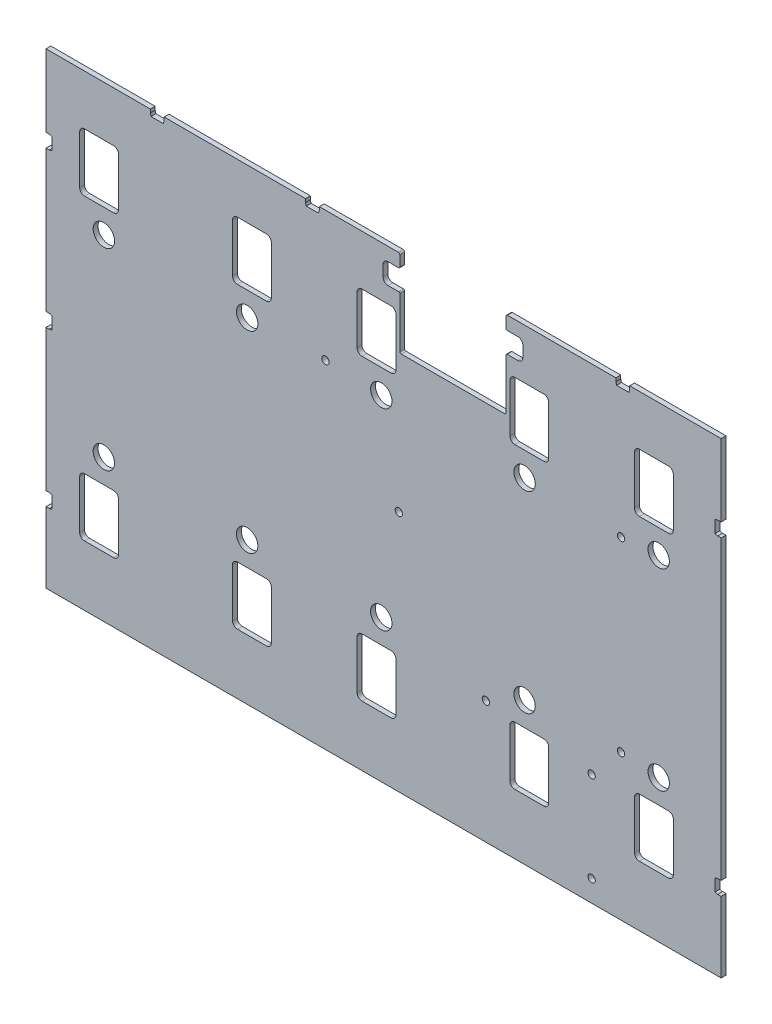
from build123d import *

# Parameters (mm, degrees)
SKETCH1_W            = 441.979400076
SKETCH1_H            = 305.81676
BOSS_EXTRUDE1_DEPTH  = 3.175
CUT_EXTRUDE1_DEPTH   = 271.654843319
CUT_EXTRUDE2_DEPTH   = 271.654843319
LPATTERN1_COUNT      = 3
LPATTERN1_PITCH      = 181.613999992
LPATTERN2_COUNT      = 2
LPATTERN2_PITCH      = 181.613999992
CUT_EXTRUDE3_DEPTH   = 271.654843319
SKETCH5_R            = 7
CUT_EXTRUDE4_DEPTH   = 271.654843319
M4_CLEARANCE_HOLE1_D = 4.8
FILLET1_R            = 1
CUT_EXTRUDE5_DEPTH   = 271.654843319


with BuildPart() as part:
    # Sketch1 → Boss-Extrude1 (new body)
    with BuildSketch(Plane.XY):
        with Locations((0, -3.32067)):
            Rectangle(SKETCH1_W, SKETCH1_H)
    extrude(amount=BOSS_EXTRUDE1_DEPTH)

    # Sketch2 → Cut-Extrude1 (cut, through all)
    with BuildSketch(Plane.XY.offset(3.175)):
        with BuildLine():
            Line((-176.7105, 116.8), (-195.7605, 116.8))
            ThreePointArc((-195.7605, 116.8), (-198.00556403, 115.87006403), (-198.9355, 113.625))
            Line((-198.9355, 113.625), (-198.9355, 81.875))
            ThreePointArc((-198.9355, 81.875), (-198.00556403, 79.62993597), (-195.7605, 78.7))
            Line((-195.7605, 78.7), (-176.7105, 78.7))
            ThreePointArc((-176.7105, 78.7), (-174.46543597, 79.62993597), (-173.5355, 81.875))
            Line((-173.5355, 81.875), (-173.5355, 113.625))
            ThreePointArc((-173.5355, 113.625), (-174.46543597, 115.87006403), (-176.7105, 116.8))
        make_face()
        with BuildLine():
            Line((-176.7105, -78.7), (-195.7605, -78.7))
            ThreePointArc((-195.7605, -78.7), (-198.00556403, -79.62993597), (-198.9355, -81.875))
            Line((-198.9355, -81.875), (-198.9355, -113.625))
            ThreePointArc((-198.9355, -113.625), (-198.00556403, -115.87006403), (-195.7605, -116.8))
            Line((-195.7605, -116.8), (-176.7105, -116.8))
            ThreePointArc((-176.7105, -116.8), (-174.46543597, -115.87006403), (-173.5355, -113.625))
            Line((-173.5355, -113.625), (-173.5355, -81.875))
            ThreePointArc((-173.5355, -81.875), (-174.46543597, -79.62993597), (-176.7105, -78.7))
        make_face()
    cut_extrude1 = extrude(amount=-CUT_EXTRUDE1_DEPTH, mode=Mode.SUBTRACT)

    # Sketch3 → Cut-Extrude2 (cut, through all)
    with BuildSketch(Plane.XY.offset(3.175)):
        with BuildLine():
            ThreePointArc((-73.4905, 113.625), (-74.42043597, 115.87006403), (-76.6655, 116.8))
            Line((-76.6655, 116.8), (-95.7155, 116.8))
            ThreePointArc((-95.7155, 116.8), (-97.96056403, 115.87006403), (-98.8905, 113.625))
            Line((-98.8905, 113.625), (-98.8905, 81.875))
            ThreePointArc((-98.8905, 81.875), (-97.96056403, 79.62993597), (-95.7155, 78.7))
            Line((-95.7155, 78.7), (-76.6655, 78.7))
            ThreePointArc((-76.6655, 78.7), (-74.42043597, 79.62993597), (-73.4905, 81.875))
            Line((-73.4905, 81.875), (-73.4905, 113.625))
        make_face()
        with BuildLine():
            ThreePointArc((-98.8905, -113.625), (-97.96056403, -115.87006403), (-95.7155, -116.8))
            Line((-95.7155, -116.8), (-76.6655, -116.8))
            ThreePointArc((-76.6655, -116.8), (-74.42043597, -115.87006403), (-73.4905, -113.625))
            Line((-73.4905, -113.625), (-73.4905, -81.875))
            ThreePointArc((-73.4905, -81.875), (-74.42043597, -79.62993597), (-76.6655, -78.7))
            Line((-76.6655, -78.7), (-95.7155, -78.7))
            ThreePointArc((-95.7155, -78.7), (-97.96056403, -79.62993597), (-98.8905, -81.875))
            Line((-98.8905, -81.875), (-98.8905, -113.625))
        make_face()
    cut_extrude2 = extrude(amount=-CUT_EXTRUDE2_DEPTH, mode=Mode.SUBTRACT)

    # LPattern1: Cut-Extrude1 ×3
    with Locations(*[(i * LPATTERN1_PITCH, 0, 0) for i in range(1, LPATTERN1_COUNT)]):
        add(cut_extrude1, mode=Mode.SUBTRACT)

    # LPattern2: Cut-Extrude2 ×2
    with Locations(*[(i * LPATTERN2_PITCH, 0, 0) for i in range(1, LPATTERN2_COUNT)]):
        add(cut_extrude2, mode=Mode.SUBTRACT)

    # Sketch4 → Cut-Extrude3 (cut, through all)
    with BuildSketch(Plane.XY.offset(3.175)):
        with BuildLine():
            ThreePointArc((9.900999992, 127.31771), (10.417187942, 127.10389795), (10.630999992, 126.58771))
            Line((10.630999992, 126.58771), (10.630999992, 92.81771))
            Line((10.630999992, 92.81771), (80.170999992, 92.81771))
            Line((80.170999992, 92.81771), (80.170999992, 126.58771))
            ThreePointArc((80.170999992, 126.58771), (80.384812042, 127.10389795), (80.900999992, 127.31771))
            Line((80.900999992, 127.31771), (87.900999992, 127.31771))
            ThreePointArc((87.900999992, 127.31771), (90.213239166, 128.275470826), (91.170999992, 130.58771))
            Line((91.170999992, 130.58771), (91.170999992, 137.58771))
            ThreePointArc((91.170999992, 137.58771), (90.213239166, 139.899949174), (87.900999992, 140.85771))
            Line((87.900999992, 140.85771), (80.900999992, 140.85771))
            ThreePointArc((80.900999992, 140.85771), (80.384812042, 141.07152205), (80.170999992, 141.58771))
            Line((80.170999992, 141.58771), (80.170999992, 149.58771))
            Line((80.170999992, 149.58771), (10.630999992, 149.58771))
            Line((10.630999992, 149.58771), (10.630999992, 141.58771))
            ThreePointArc((10.630999992, 141.58771), (10.417187942, 141.07152205), (9.900999992, 140.85771))
            Line((9.900999992, 140.85771), (2.900999992, 140.85771))
            ThreePointArc((2.900999992, 140.85771), (0.588760818, 139.899949174), (-0.369000008, 137.58771))
            Line((-0.369000008, 137.58771), (-0.369000008, 130.58771))
            ThreePointArc((-0.369000008, 130.58771), (0.588760818, 128.275470826), (2.900999992, 127.31771))
            Line((2.900999992, 127.31771), (9.900999992, 127.31771))
        make_face()
        with BuildLine():
            Line((2.900999992, 139.58771), (9.900999992, 139.58771))
            ThreePointArc((9.900999992, 139.58771), (11.315213554, 140.173496438), (11.900999992, 141.58771))
            Line((11.900999992, 141.58771), (11.900999992, 126.58771))
            ThreePointArc((11.900999992, 126.58771), (11.315213554, 128.001923562), (9.900999992, 128.58771))
            Line((9.900999992, 128.58771), (2.900999992, 128.58771))
            ThreePointArc((2.900999992, 128.58771), (1.48678643, 129.173496438), (0.900999992, 130.58771))
            Line((0.900999992, 130.58771), (0.900999992, 137.58771))
            ThreePointArc((0.900999992, 137.58771), (1.48678643, 139.001923562), (2.900999992, 139.58771))
        make_face(mode=Mode.SUBTRACT)
        with BuildLine():
            ThreePointArc((78.900999992, 141.58771), (79.48678643, 140.173496438), (80.900999992, 139.58771))
            Line((80.900999992, 139.58771), (87.900999992, 139.58771))
            ThreePointArc((87.900999992, 139.58771), (89.315213554, 139.001923562), (89.900999992, 137.58771))
            Line((89.900999992, 137.58771), (89.900999992, 130.58771))
            ThreePointArc((89.900999992, 130.58771), (89.315213554, 129.173496438), (87.900999992, 128.58771))
            Line((87.900999992, 128.58771), (80.900999992, 128.58771))
            ThreePointArc((80.900999992, 128.58771), (79.48678643, 128.001923562), (78.900999992, 126.58771))
            Line((78.900999992, 126.58771), (78.900999992, 141.58771))
        make_face(mode=Mode.SUBTRACT)
    extrude(amount=-CUT_EXTRUDE3_DEPTH, mode=Mode.SUBTRACT)


with BuildPart() as cut_extrude3_kept_piece:
    # of the separate pieces the step leaves, the one the design keeps (cut_extrude3_pieces_kept)
    add(part.part.solids().sort_by_distance((220.989700038, 149.58771, 0))[0])

    # Sketch5 → Cut-Extrude4 (cut, through all)
    with BuildSketch(Plane.XY.offset(3.175)):
        with Locations((-183.117651545, 63.008899223)):
            Circle(SKETCH5_R)
        with Locations((-183.117651545, -63.008899223)):
            Circle(SKETCH5_R)
        with Locations((-89.308348455, -63.008899223)):
            Circle(SKETCH5_R)
        with Locations((-89.308348455, 63.008899223)):
            Circle(SKETCH5_R)
        with Locations((180.110348439, -63.008899223)):
            Circle(SKETCH5_R)
        with Locations((180.110348439, 63.008899223)):
            Circle(SKETCH5_R)
        with Locations((92.305651537, 63.008899223)):
            Circle(SKETCH5_R)
        with Locations((92.305651537, -63.008899223)):
            Circle(SKETCH5_R)
        with Locations((-1.503651553, -63.008899223)):
            Circle(SKETCH5_R)
        with Locations((-1.503651553, 63.008899223)):
            Circle(SKETCH5_R)
    extrude(amount=-CUT_EXTRUDE4_DEPTH, mode=Mode.SUBTRACT)

    # M4 Clearance Hole1 (through all)
    with Locations(Plane.XY.offset(3.175)):
        with Locations((-38.010299962, 64.5), (9.989700038, 2.5), (66.989700038, -76), (136.207999988, -142.21600002), (136.207999988, -83.21600002), (155.489700038, -61), (155.489700038, 61)):
            Hole(M4_CLEARANCE_HOLE1_D / 2)

    # Fillet1
    fillet1_edges = [cut_extrude3_kept_piece.edges().sort_by_distance(p)[0] for p in [
        (10.630999992, 92.81771, 1.5875),
        (80.170999992, 92.81771, 1.5875),
        (80.170999992, 149.58771, 1.5875),
        (10.630999992, 149.58771, 1.5875),
    ]]
    fillet(fillet1_edges, radius=FILLET1_R)

    # Sketch8 → Cut-Extrude5 (cut, through all)
    with BuildSketch(Plane.XY.offset(3.175)):
        with BuildLine():
            Line((223.754700038, 93.083202416), (223.754700038, 92.526512865))
            Line((223.754700038, 92.526512865), (220.989700038, 92.526512865))
            Line((220.989700038, 92.526512865), (220.989700038, 93.26595))
            Line((220.989700038, 93.26595), (218.73804754, 93.26595))
            Line((218.73804754, 93.26595), (216.989700038, 93.734418301))
            Line((216.989700038, 93.734418301), (216.989700038, 101.807481699))
            Line((216.989700038, 101.807481699), (218.73804754, 102.27595))
            Line((218.73804754, 102.27595), (220.989700038, 102.27595))
            Line((220.989700038, 102.27595), (220.989700038, 103.015387135))
            Line((220.989700038, 103.015387135), (223.754700038, 103.015387135))
            Line((223.754700038, 103.015387135), (223.754700038, 102.458697584))
            ThreePointArc((223.754700038, 102.458697584), (224.308097472, 102.059602449), (224.519700038, 101.41095))
            Line((224.519700038, 101.41095), (224.519700038, 94.13095))
            ThreePointArc((224.519700038, 94.13095), (224.308097472, 93.482297551), (223.754700038, 93.083202416))
        make_face()
        with BuildLine():
            Line((-224.519700038, 94.13095), (-224.519700038, 101.41095))
            ThreePointArc((-224.519700038, 101.41095), (-224.308097472, 102.059602449), (-223.754700038, 102.458697584))
            Line((-223.754700038, 102.458697584), (-223.754700038, 103.015387135))
            Line((-223.754700038, 103.015387135), (-220.989700038, 103.015387135))
            Line((-220.989700038, 103.015387135), (-220.989700038, 102.27595))
            Line((-220.989700038, 102.27595), (-218.73804754, 102.27595))
            Line((-218.73804754, 102.27595), (-216.989700038, 101.807481699))
            Line((-216.989700038, 101.807481699), (-216.989700038, 93.734418301))
            Line((-216.989700038, 93.734418301), (-218.73804754, 93.26595))
            Line((-218.73804754, 93.26595), (-220.989700038, 93.26595))
            Line((-220.989700038, 93.26595), (-220.989700038, 92.526512865))
            Line((-220.989700038, 92.526512865), (-223.754700038, 92.526512865))
            Line((-223.754700038, 92.526512865), (-223.754700038, 93.083202416))
            ThreePointArc((-223.754700038, 93.083202416), (-224.308097472, 93.482297551), (-224.519700038, 94.13095))
        make_face()
        with BuildLine():
            Line((224.519700038, -101.78905), (224.519700038, -109.06905))
            ThreePointArc((224.519700038, -109.06905), (224.308097472, -109.717702449), (223.754700038, -110.116797584))
            Line((223.754700038, -110.116797584), (223.754700038, -110.658869179))
            Line((223.754700038, -110.658869179), (220.989700038, -110.658869179))
            Line((220.989700038, -110.658869179), (220.989700038, -109.93405))
            Line((220.989700038, -109.93405), (218.73804754, -109.93405))
            Line((218.73804754, -109.93405), (216.989700038, -109.465581699))
            Line((216.989700038, -109.465581699), (216.989700038, -101.392518301))
            Line((216.989700038, -101.392518301), (218.73804754, -100.92405))
            Line((218.73804754, -100.92405), (220.989700038, -100.92405))
            Line((220.989700038, -100.92405), (220.989700038, -100.199230821))
            Line((220.989700038, -100.199230821), (223.754700038, -100.199230821))
            Line((223.754700038, -100.199230821), (223.754700038, -100.741302416))
            ThreePointArc((223.754700038, -100.741302416), (224.308097472, -101.140397551), (224.519700038, -101.78905))
        make_face()
        with BuildLine():
            Line((-223.754700038, 0.858697584), (-223.754700038, 1.400769179))
            Line((-223.754700038, 1.400769179), (-220.989700038, 1.400769179))
            Line((-220.989700038, 1.400769179), (-220.989700038, 0.67595))
            Line((-220.989700038, 0.67595), (-218.73804754, 0.67595))
            Line((-218.73804754, 0.67595), (-216.989700038, 0.207481699))
            Line((-216.989700038, 0.207481699), (-216.989700038, -7.865581699))
            Line((-216.989700038, -7.865581699), (-218.73804754, -8.33405))
            Line((-218.73804754, -8.33405), (-220.989700038, -8.33405))
            Line((-220.989700038, -8.33405), (-220.989700038, -9.058869179))
            Line((-220.989700038, -9.058869179), (-223.754700038, -9.058869179))
            Line((-223.754700038, -9.058869179), (-223.754700038, -8.516797584))
            ThreePointArc((-223.754700038, -8.516797584), (-224.308097472, -8.117702449), (-224.519700038, -7.46905))
            Line((-224.519700038, -7.46905), (-224.519700038, -0.18905))
            ThreePointArc((-224.519700038, -0.18905), (-224.308097472, 0.459602449), (-223.754700038, 0.858697584))
        make_face()
        with BuildLine():
            Line((-223.754700038, -100.741302416), (-223.754700038, -100.199230821))
            Line((-223.754700038, -100.199230821), (-220.989700038, -100.199230821))
            Line((-220.989700038, -100.199230821), (-220.989700038, -100.92405))
            Line((-220.989700038, -100.92405), (-218.73804754, -100.92405))
            Line((-218.73804754, -100.92405), (-216.989700038, -101.392518301))
            Line((-216.989700038, -101.392518301), (-216.989700038, -109.465581699))
            Line((-216.989700038, -109.465581699), (-218.73804754, -109.93405))
            Line((-218.73804754, -109.93405), (-220.989700038, -109.93405))
            Line((-220.989700038, -109.93405), (-220.989700038, -110.658869179))
            Line((-220.989700038, -110.658869179), (-223.754700038, -110.658869179))
            Line((-223.754700038, -110.658869179), (-223.754700038, -110.116797584))
            ThreePointArc((-223.754700038, -110.116797584), (-224.308097472, -109.717702449), (-224.519700038, -109.06905))
            Line((-224.519700038, -109.06905), (-224.519700038, -101.78905))
            ThreePointArc((-224.519700038, -101.78905), (-224.308097472, -101.140397551), (-223.754700038, -100.741302416))
        make_face()
        with BuildLine():
            Line((152.950006743, 153.11771), (160.230006743, 153.11771))
            ThreePointArc((160.230006743, 153.11771), (160.878659192, 152.906107434), (161.277754327, 152.35271))
            Line((161.277754327, 152.35271), (161.83965744, 152.35271))
            Line((161.83965744, 152.35271), (161.83965744, 149.58771))
            Line((161.83965744, 149.58771), (161.095006743, 149.58771))
            Line((161.095006743, 149.58771), (161.095006743, 147.336057502))
            Line((161.095006743, 147.336057502), (160.626538442, 145.58771))
            Line((160.626538442, 145.58771), (158.491670732, 145.58771))
            Line((158.491670732, 145.58771), (158.452461628, 145.58771))
            Line((158.452461628, 145.58771), (158.121947003, 145.58771))
            Line((158.121947003, 145.58771), (155.779944773, 145.58771))
            Line((155.779944773, 145.58771), (155.47410616, 145.58771))
            Line((155.47410616, 145.58771), (155.342804928, 145.58771))
            Line((155.342804928, 145.58771), (153.878280784, 145.58771))
            Line((153.878280784, 145.58771), (153.611651275, 145.58771))
            Line((153.611651275, 145.58771), (152.553475045, 145.58771))
            Line((152.553475045, 145.58771), (152.085006743, 147.336057502))
            Line((152.085006743, 147.336057502), (152.085006743, 149.58771))
            Line((152.085006743, 149.58771), (151.340356046, 149.58771))
            Line((151.340356046, 149.58771), (151.340356046, 152.35271))
            Line((151.340356046, 152.35271), (151.902259159, 152.35271))
            ThreePointArc((151.902259159, 152.35271), (152.301354294, 152.906107434), (152.950006743, 153.11771))
        make_face()
        with BuildLine():
            Line((-50.249993257, 153.11771), (-42.969993257, 153.11771))
            ThreePointArc((-42.969993257, 153.11771), (-42.321340808, 152.906107434), (-41.922245673, 152.35271))
            Line((-41.922245673, 152.35271), (-41.36034256, 152.35271))
            Line((-41.36034256, 152.35271), (-41.36034256, 149.58771))
            Line((-41.36034256, 149.58771), (-42.104993257, 149.58771))
            Line((-42.104993257, 149.58771), (-42.104993257, 147.336057502))
            Line((-42.104993257, 147.336057502), (-42.573461558, 145.58771))
            Line((-42.573461558, 145.58771), (-44.708329268, 145.58771))
            Line((-44.708329268, 145.58771), (-44.747538372, 145.58771))
            Line((-44.747538372, 145.58771), (-45.078052997, 145.58771))
            Line((-45.078052997, 145.58771), (-47.420055227, 145.58771))
            Line((-47.420055227, 145.58771), (-47.72589384, 145.58771))
            Line((-47.72589384, 145.58771), (-47.857195072, 145.58771))
            Line((-47.857195072, 145.58771), (-49.321719216, 145.58771))
            Line((-49.321719216, 145.58771), (-49.588348725, 145.58771))
            Line((-49.588348725, 145.58771), (-50.646524955, 145.58771))
            Line((-50.646524955, 145.58771), (-51.114993257, 147.336057502))
            Line((-51.114993257, 147.336057502), (-51.114993257, 149.58771))
            Line((-51.114993257, 149.58771), (-51.859643954, 149.58771))
            Line((-51.859643954, 149.58771), (-51.859643954, 152.35271))
            Line((-51.859643954, 152.35271), (-51.297740841, 152.35271))
            ThreePointArc((-51.297740841, 152.35271), (-50.898645706, 152.906107434), (-50.249993257, 153.11771))
        make_face()
        with BuildLine():
            Line((-151.849993257, 153.11771), (-144.569993257, 153.11771))
            ThreePointArc((-144.569993257, 153.11771), (-143.921340808, 152.906107434), (-143.522245673, 152.35271))
            Line((-143.522245673, 152.35271), (-142.96034256, 152.35271))
            Line((-142.96034256, 152.35271), (-142.96034256, 149.58771))
            Line((-142.96034256, 149.58771), (-143.704993257, 149.58771))
            Line((-143.704993257, 149.58771), (-143.704993257, 147.336057502))
            Line((-143.704993257, 147.336057502), (-144.173461558, 145.58771))
            Line((-144.173461558, 145.58771), (-146.308329268, 145.58771))
            Line((-146.308329268, 145.58771), (-146.347538372, 145.58771))
            Line((-146.347538372, 145.58771), (-146.678052997, 145.58771))
            Line((-146.678052997, 145.58771), (-149.020055227, 145.58771))
            Line((-149.020055227, 145.58771), (-149.32589384, 145.58771))
            Line((-149.32589384, 145.58771), (-149.457195072, 145.58771))
            Line((-149.457195072, 145.58771), (-150.921719216, 145.58771))
            Line((-150.921719216, 145.58771), (-151.188348725, 145.58771))
            Line((-151.188348725, 145.58771), (-152.246524955, 145.58771))
            Line((-152.246524955, 145.58771), (-152.714993257, 147.336057502))
            Line((-152.714993257, 147.336057502), (-152.714993257, 149.58771))
            Line((-152.714993257, 149.58771), (-153.459643954, 149.58771))
            Line((-153.459643954, 149.58771), (-153.459643954, 152.35271))
            Line((-153.459643954, 152.35271), (-152.897740841, 152.35271))
            ThreePointArc((-152.897740841, 152.35271), (-152.498645706, 152.906107434), (-151.849993257, 153.11771))
        make_face()
    extrude(amount=-CUT_EXTRUDE5_DEPTH, mode=Mode.SUBTRACT)


solid = cut_extrude3_kept_piece.part
